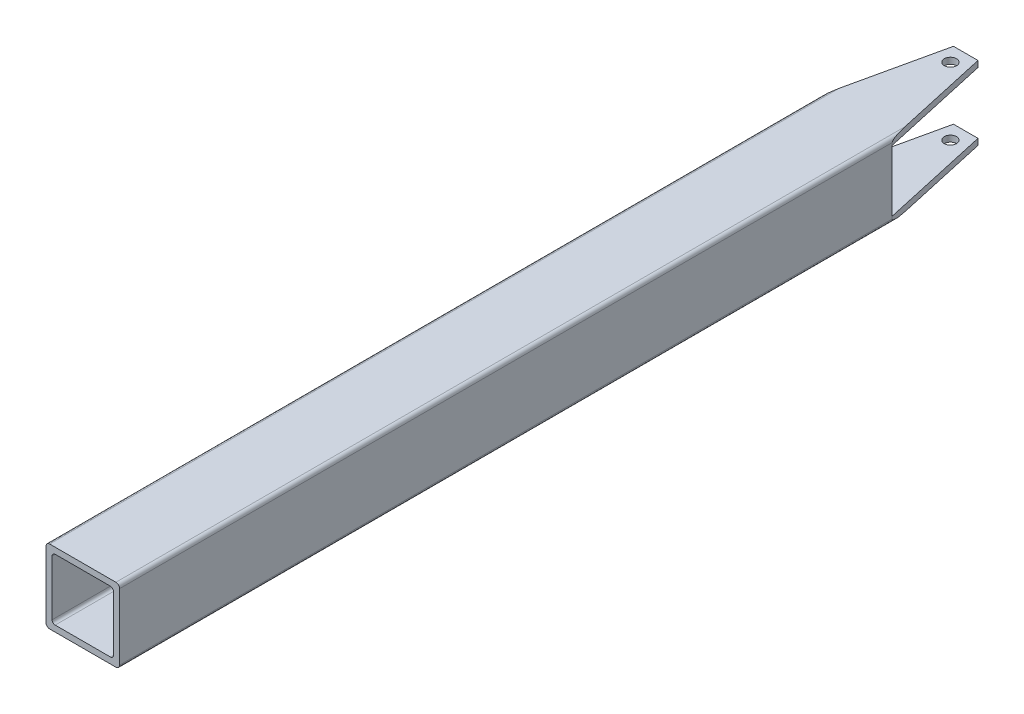
from build123d import *

# Parameters (mm, degrees)
BOSS_EXTRUDE1_DEPTH      = 457.2
BOSS_EXTRUDE1_DEPTH_BACK = 457.2
SKETCH6_W                = 114.3
SKETCH6_H                = 63.5
SIDE_CUT_DEPTH           = 466.069768959
TRIANGLE_CUT_DEPTH       = 466.069768959
SKETCH8_R                = 6.35
CUT_EXTRUDE4_DEPTH       = 466.069768959


with BuildPart() as part:
    # Sketch4 → Boss-Extrude1 (new, two sides: drawn at the far end of the back side and taken through both)
    with BuildSketch(Plane.XY.offset(-BOSS_EXTRUDE1_DEPTH_BACK)):
        with BuildLine():
            Line((38.1, -34.29), (38.1, 34.29))
            ThreePointArc((38.1, 34.29), (36.984076836, 36.984076836), (34.29, 38.1))
            Line((34.29, 38.1), (-34.29, 38.1))
            ThreePointArc((-34.29, 38.1), (-36.984076836, 36.984076836), (-38.1, 34.29))
            Line((-38.1, 34.29), (-38.1, -34.29))
            ThreePointArc((-38.1, -34.29), (-36.984076836, -36.984076836), (-34.29, -38.1))
            Line((-34.29, -38.1), (34.29, -38.1))
            ThreePointArc((34.29, -38.1), (36.984076836, -36.984076836), (38.1, -34.29))
        make_face()
        with BuildLine():
            Line((31.75, 28.575), (31.75, -28.575))
            ThreePointArc((31.75, -28.575), (30.82006403, -30.82006403), (28.575, -31.75))
            Line((28.575, -31.75), (-28.575, -31.75))
            ThreePointArc((-28.575, -31.75), (-30.82006403, -30.82006403), (-31.75, -28.575))
            Line((-31.75, -28.575), (-31.75, 28.575))
            ThreePointArc((-31.75, 28.575), (-30.82006403, 30.82006403), (-28.575, 31.75))
            Line((-28.575, 31.75), (28.575, 31.75))
            ThreePointArc((28.575, 31.75), (30.82006403, 30.82006403), (31.75, 28.575))
        make_face(mode=Mode.SUBTRACT)
    extrude(amount=BOSS_EXTRUDE1_DEPTH + BOSS_EXTRUDE1_DEPTH_BACK)

    # Sketch6 → side cut (cut, through all)
    with BuildSketch(Plane.ZY.offset(38.1)):
        with Locations((-400.05, 0)):
            Rectangle(SKETCH6_W, SKETCH6_H)
    extrude(amount=-SIDE_CUT_DEPTH, mode=Mode.SUBTRACT)

    # Sketch7 → triangle cut (cut, through all)
    with BuildSketch(Plane.XZ.offset(38.1)):
        Polygon((-38.1, -342.9), (-38.1, -457.2), (-12.7, -457.2), align=None)
        Polygon((12.7, -457.2), (38.1, -342.9), (38.1, -457.2), align=None)
    extrude(amount=-TRIANGLE_CUT_DEPTH, mode=Mode.SUBTRACT)

    # Sketch8 → Cut-Extrude4 (cut, through all)
    with BuildSketch(Plane(origin=(0, 38.1, 0), x_dir=(1, 0, 0), z_dir=(0, 1, 0))):
        with Locations(Location((0, 441.325, 0), (0, 0, 270))):
            Circle(SKETCH8_R)
    extrude(amount=-CUT_EXTRUDE4_DEPTH, mode=Mode.SUBTRACT)


solid = part.part
